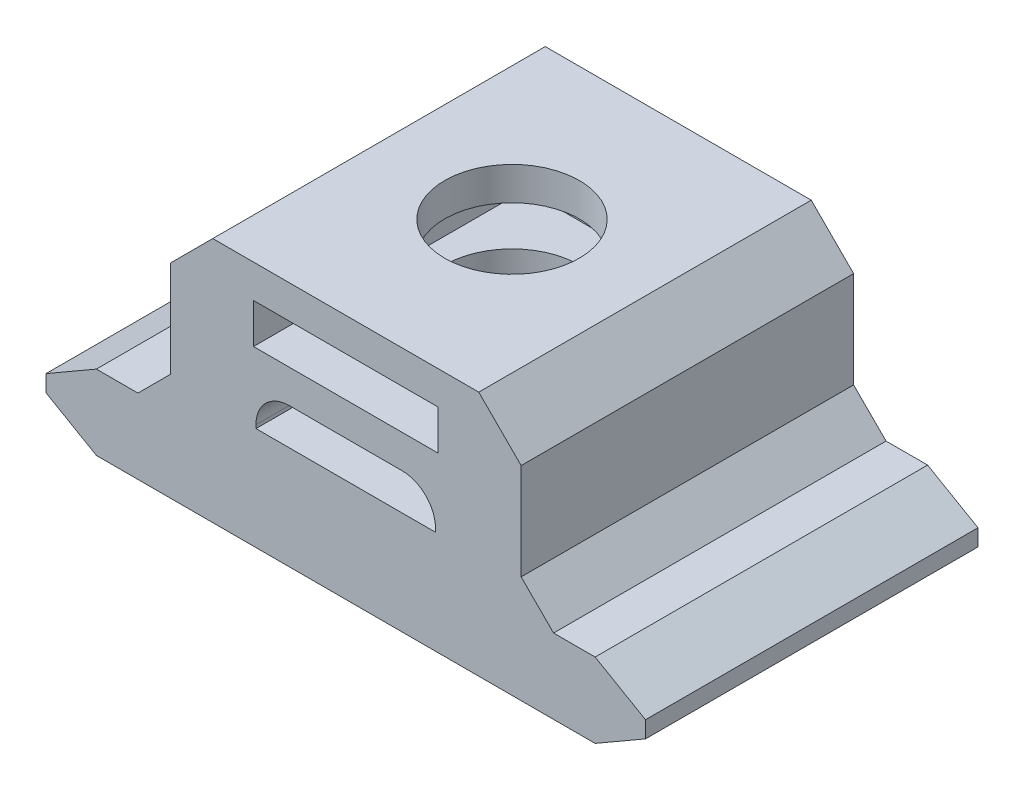
from build123d import *

# Parameters (mm, degrees)
SKETCH1_W           = 11.1
SKETCH1_H           = 2.4
BOSS_EXTRUDE1_DEPTH = 20
CUT_EXTRUDE1_REACH  = 32.727
SKETCH2_R           = 4.05
SKETCH4_W           = 11.1
SKETCH4_H           = 3.65
BOSS_EXTRUDE3_DEPTH = 4.4
BOSS_EXTRUDE4_DEPTH = 1.9
BOSS_EXTRUDE5_DEPTH = 5.9


with BuildPart() as part:
    # Sketch1 → Boss-Extrude1 (new body)
    with BuildSketch(Plane.XY):
        with BuildLine():
            Line((-10.5, 0), (-3.5, 0))
            Line((-3.5, 0), (-3.5, -1.6))
            Line((-3.5, -1.6), (-15, -1.6))
            Line((-15, -1.6), (-18.031088913, 0.15))
            Line((-18.031088913, 0.15), (-18.031088913, 1.15))
            Line((-18.031088913, 1.15), (-15, 2.9))
            Line((-15, 2.9), (-12.5, 2.9))
            Line((-12.5, 2.9), (-10.55, 4.85))
            Line((-10.55, 4.85), (-10.55, 10.65))
            Line((-10.55, 10.65), (-8, 13.2))
            Line((-8, 13.2), (8, 13.2))
            Line((8, 13.2), (10.55, 10.65))
            Line((10.55, 10.65), (10.55, 4.85))
            Line((10.55, 4.85), (12.5, 2.9))
            Line((12.5, 2.9), (15, 2.9))
            Line((15, 2.9), (18.031088913, 1.15))
            Line((18.031088913, 1.15), (18.031088913, 0.15))
            Line((18.031088913, 0.15), (15, -1.6))
            Line((15, -1.6), (3.5, -1.6))
            Line((3.5, -1.6), (3.5, 0))
            Line((3.5, 0), (10.5, 0))
            Line((10.5, 0), (10.5, 1.7))
            Line((10.5, 1.7), (5.4, 1.7))
            Line((5.4, 1.7), (5.4, 4.8))
            ThreePointArc((5.4, 4.8), (4.814213562, 6.214213562), (3.4, 6.8))
            Line((3.4, 6.8), (-3.4, 6.8))
            ThreePointArc((-3.4, 6.8), (-4.814213562, 6.214213562), (-5.4, 4.8))
            Line((-5.4, 4.8), (-5.4, 1.7))
            Line((-5.4, 1.7), (-10.5, 1.7))
            Line((-10.5, 1.7), (-10.5, 0))
        make_face()
        with Locations((0, 10)):
            Rectangle(SKETCH1_W, SKETCH1_H, mode=Mode.SUBTRACT)
    extrude(amount=BOSS_EXTRUDE1_DEPTH)

    # Cut-Extrude1: up to this face of the body (flat: up to its plane)
    cut_extrude1_end = Plane(part.part.faces().sort_by_distance((7, 0, 10))[0])
    # Sketch2 → Cut-Extrude1 (cut, up to the picked face)
    with BuildSketch(Plane(origin=(0, 13.2, 0), x_dir=(1, 0, 0), z_dir=(0, 1, 0)), mode=Mode.PRIVATE) as cut_extrude1_sk1:
        with Locations(Location((0, -10, 0), (0, 0, 270))):
            Circle(SKETCH2_R)
    cut_extrude1_tool1 = split(extrude(cut_extrude1_sk1.sketch, amount=-CUT_EXTRUDE1_REACH, mode=Mode.PRIVATE), bisect_by=cut_extrude1_end, keep=Keep.BOTH, mode=Mode.PRIVATE)
    add(cut_extrude1_tool1.solids().sort_by(Axis((0, 13.2, 10), (0, -1, 0)))[0], mode=Mode.SUBTRACT)

    # Sketch4 → Boss-Extrude3 (add)
    with BuildSketch(Plane(origin=(0, 13.2, 0), x_dir=(1, 0, 0), z_dir=(0, 1, 0))):
        with Locations((0, -1.825)):
            Rectangle(SKETCH4_W, SKETCH4_H)
    extrude(amount=-BOSS_EXTRUDE3_DEPTH)

    # Sketch5 → Boss-Extrude4 (add)
    with BuildSketch(Plane(origin=(0, 0, 0), x_dir=(-1, 0, 0), z_dir=(0, 0, -1))):
        Polygon((-10.5, 1.7), (-10.5, -1.6), (10.5, -1.6), (10.5, 1.7), (5.4, 1.7), (5.4, 4.6), (-5.4, 4.6), (-5.4, 1.7), align=None)
    extrude(amount=-BOSS_EXTRUDE4_DEPTH)

    # Sketch6 → Boss-Extrude5 (add)
    with BuildSketch(Plane.XY.offset(20)):
        Polygon((-3.5, -1.6), (-3.5, 0), (-10.5, 0), (-10.5, 1.7), (-5.4, 1.7), (-5.4, 4.6), (5.4, 4.6), (5.4, 1.7), (10.5, 1.7), (10.5, 0), (3.5, 0), (3.5, -1.6), align=None)
    extrude(amount=-BOSS_EXTRUDE5_DEPTH)


solid = part.part
